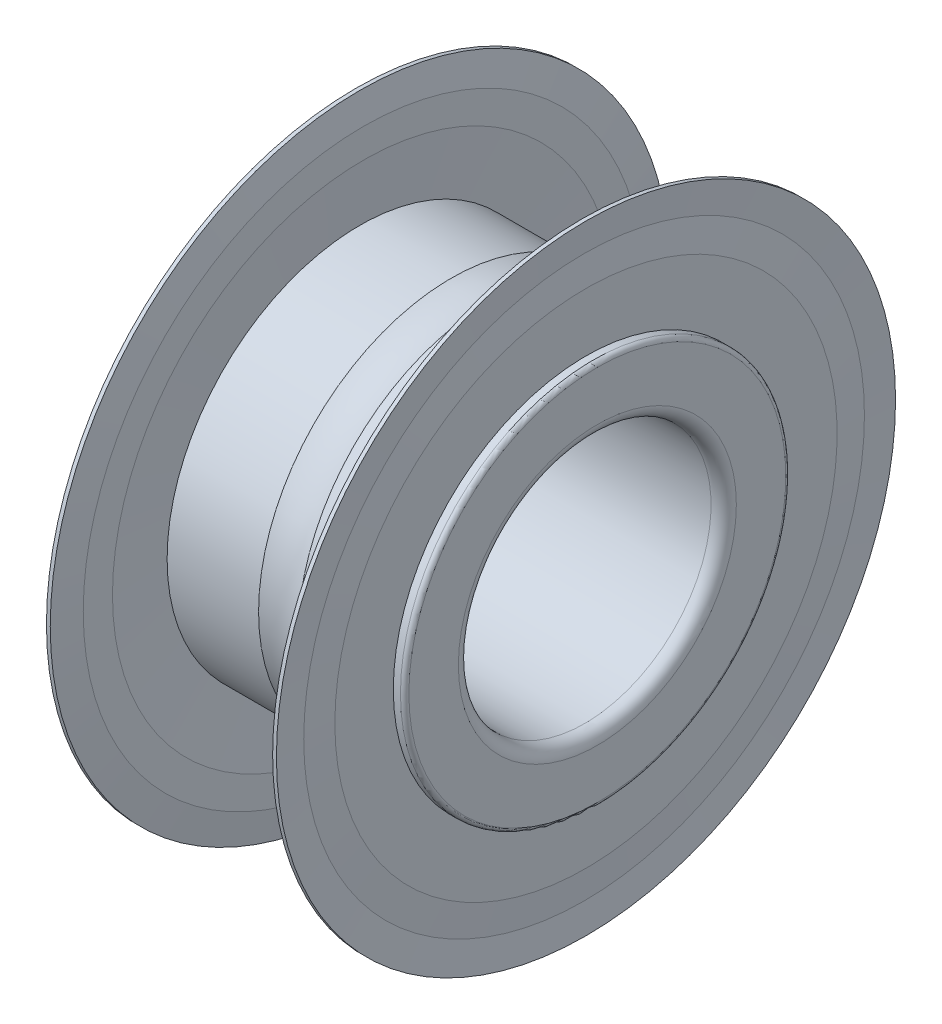
from build123d import *


with BuildPart() as part:
    # Sketch1 → Revolve1 (revolve)
    with BuildSketch(Plane.XY, mode=Mode.PRIVATE) as revolve1_sk:
        with BuildLine():
            Line((0, 2.983333333), (0, 2.2))
            ThreePointArc((0, 2.2), (0.058578644, 2.058578644), (0.2, 2))
            Line((0.2, 2), (3.8, 2))
            ThreePointArc((3.8, 2), (3.941421356, 2.058578644), (4, 2.2))
            Line((4, 2.2), (4, 2.983333333))
            ThreePointArc((4, 2.983333333), (3.980473785, 3.030473785), (3.933333333, 3.05))
            Line((3.933333333, 3.05), (2.3122499, 3.05))
            ThreePointArc((2.3122499, 3.05), (2, 3), (1.6877501, 3.05))
            Line((1.6877501, 3.05), (0.066666667, 3.05))
            ThreePointArc((0.066666667, 3.05), (0.019526215, 3.030473785), (0, 2.983333333))
        make_face()
    revolve(revolve1_sk.sketch.rotate(Axis((50, 0, 0), (-1, 0, 0)), 270), axis=Axis((50, 0, 0), (-1, 0, 0)))

    # Sketch2 → Revolve2 (revolve)
    with BuildSketch(Plane.XY, mode=Mode.PRIVATE) as revolve2_sk:
        Polygon((0.18, 4.9), (0.21, 4.4375), (0.18, 3.975), (0.18, 3.05), (0.24, 3.05), (0.3, 3.975), (0.3, 4.4375), (0.24, 4.9), align=None)
    revolve(revolve2_sk.sketch.rotate(Axis((50, 0, 0), (-1, 0, 0)), 270), axis=Axis((50, 0, 0), (-1, 0, 0)))

    # Sketch3 → Revolve3 (revolve)
    with BuildSketch(Plane.XY, mode=Mode.PRIVATE) as revolve3_sk:
        Polygon((3.7, 4.4375), (3.7, 3.975), (3.76, 3.05), (3.82, 3.05), (3.82, 3.975), (3.79, 4.4375), (3.82, 4.9), (3.76, 4.9), align=None)
    revolve(revolve3_sk.sketch.rotate(Axis((50, 0, 0), (-1, 0, 0)), 270), axis=Axis((50, 0, 0), (-1, 0, 0)))


solid = part.part
